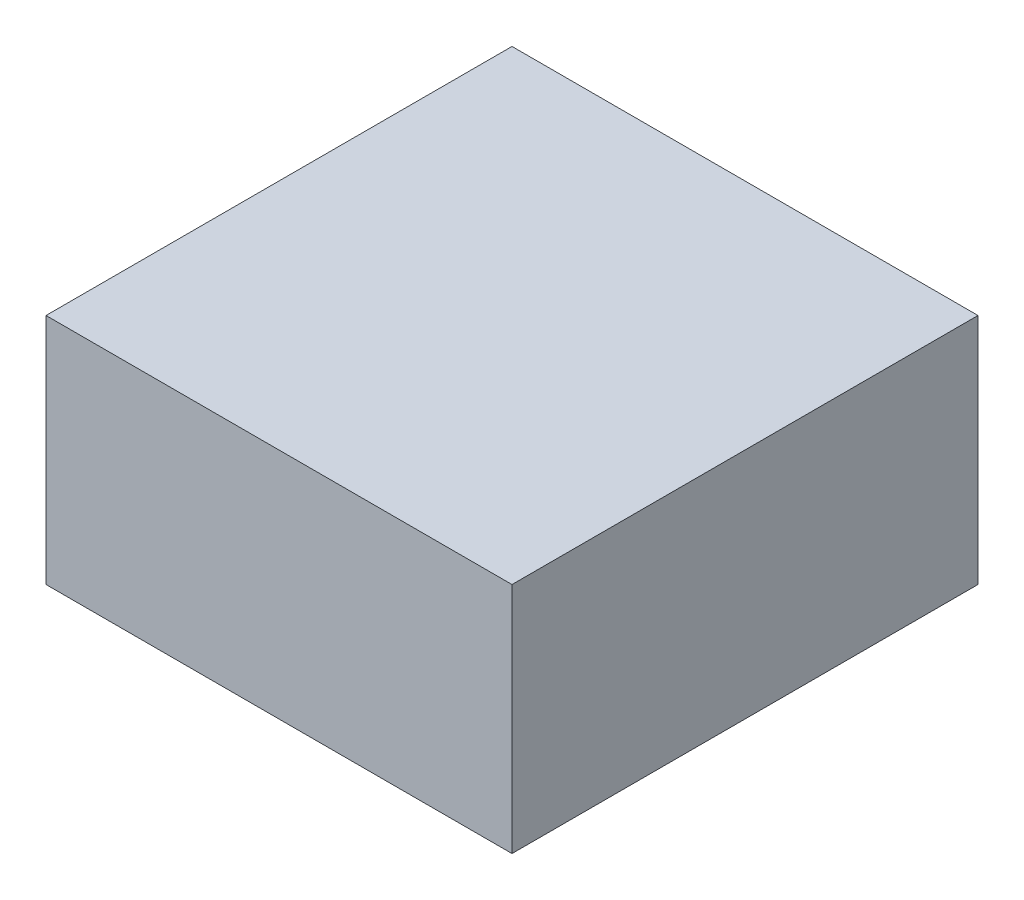
from build123d import *

# Parameters (mm, degrees)
SKETCH_1_W      = 40
SKETCH_1_H      = 40
EXTRUDE_1_DEPTH = 20


with BuildPart() as part:
    # 草图1 → 凸台-拉伸1 (new body)
    with BuildSketch(Plane(origin=(0, 0, 0), x_dir=(1, 0, 0), z_dir=(0, 1, 0))):
        Rectangle(SKETCH_1_W, SKETCH_1_H)
    extrude(amount=EXTRUDE_1_DEPTH)


solid = part.part
